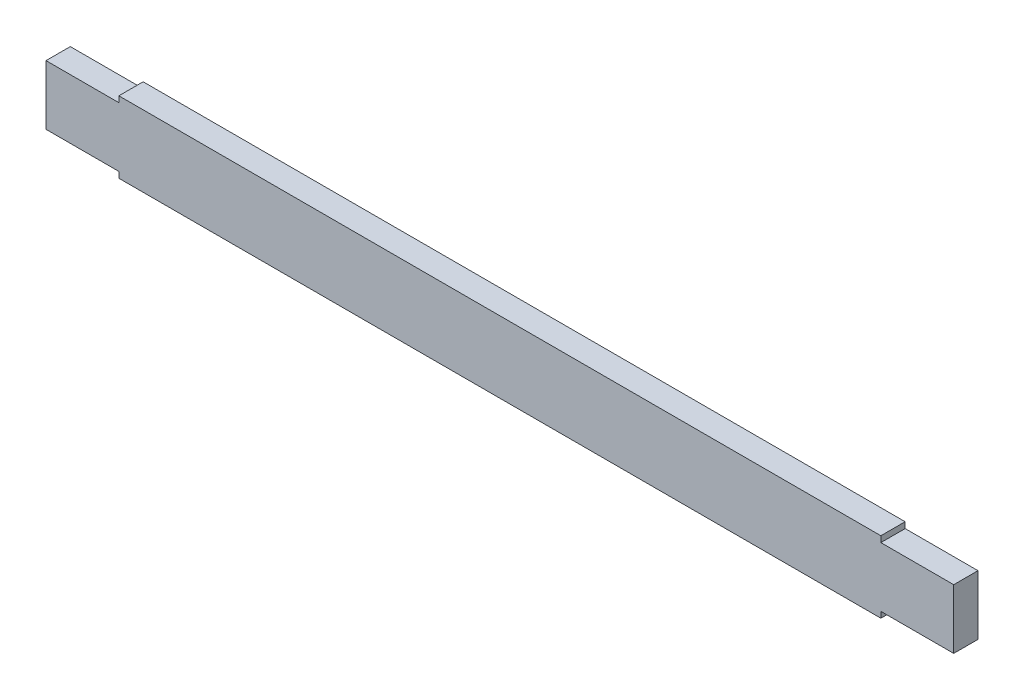
from build123d import *

# Parameters (mm, degrees)
BOSS_EXTRUDE2_DEPTH = 5.1


with BuildPart() as part:
    # Sketch1 → Boss-Extrude2 (new body)
    with BuildSketch(Plane.XY):
        Polygon((-80, 6.25), (-80, 7.5), (80, 7.5), (80, 6.25), (95.3, 6.25), (95.3, -6.25), (80, -6.25), (80, -7.5), (-80, -7.5), (-80, -6.25), (-95.3, -6.25), (-95.3, 6.25), align=None)
    extrude(amount=BOSS_EXTRUDE2_DEPTH)


solid = part.part
